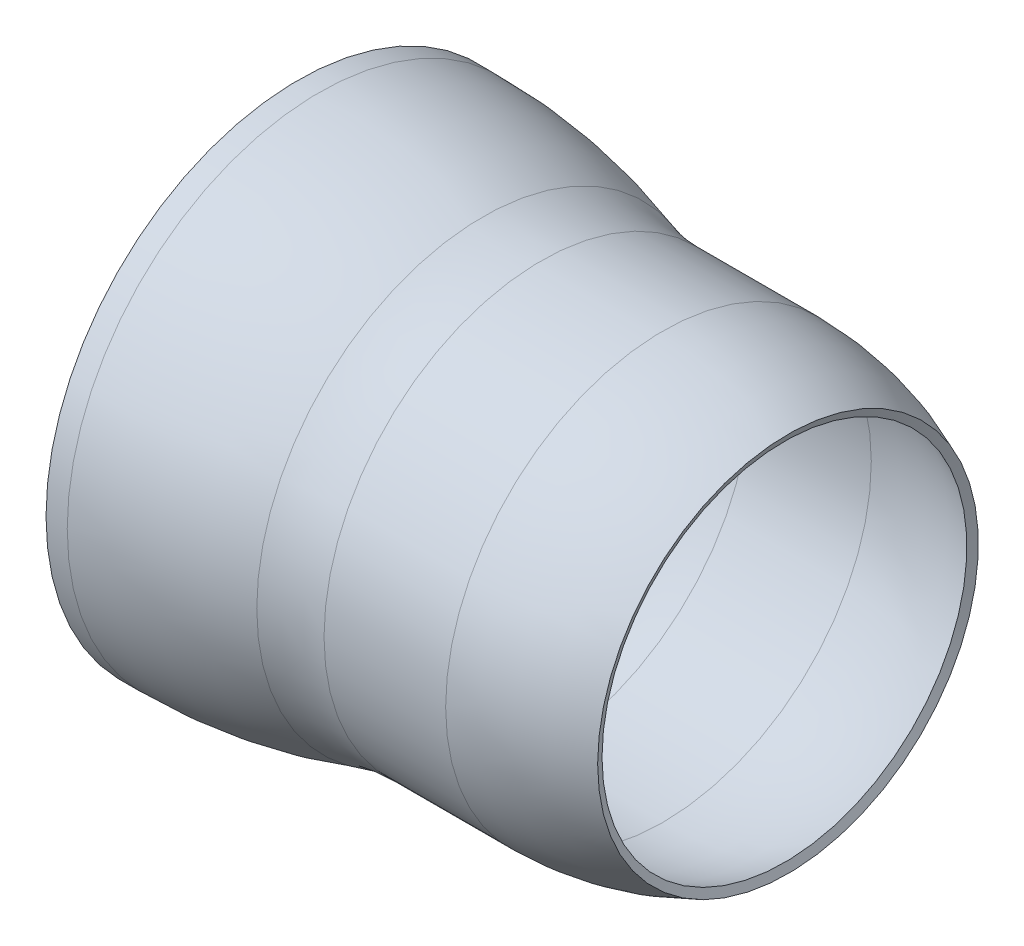
from build123d import *


with BuildPart() as part:
    # Sketch1 → Revolve1 (revolve)
    with BuildSketch(Plane.XY, mode=Mode.PRIVATE) as revolve1_sk:
        with BuildLine():
            ThreePointArc((210, 125.0000004), (246.84219817, 121.096924766), (282.048780538, 109.560975587))
            Line((282.048780538, 109.560975587), (280, 105))
            ThreePointArc((280, 105), (245.7945527, 116.207912702), (210, 120.0000004))
            Line((210, 120.0000004), (140, 120.0000004))
            ThreePointArc((140, 120.0000004), (122.286974227, 121.377708328), (105, 125.477694091))
            ThreePointArc((105, 125.477694091), (59.169265001, 136.347459879), (12.208994244, 140))
            Line((12.208994244, 140), (0, 140))
            Line((0, 140), (0, 145))
            Line((0, 145), (12.208994244, 145))
            ThreePointArc((12.208994244, 145), (59.942381599, 141.287327359), (106.527637417, 130.238610381))
            ThreePointArc((106.527637417, 130.238610381), (123.060090825, 126.317575808), (140, 125.0000004))
            Line((140, 125.0000004), (210, 125.0000004))
        make_face()
    revolve(revolve1_sk.sketch.rotate(Axis((0, 0, 0), (1, 0, 0)), 90), axis=Axis((0, 0, 0), (1, 0, 0)))


solid = part.part
